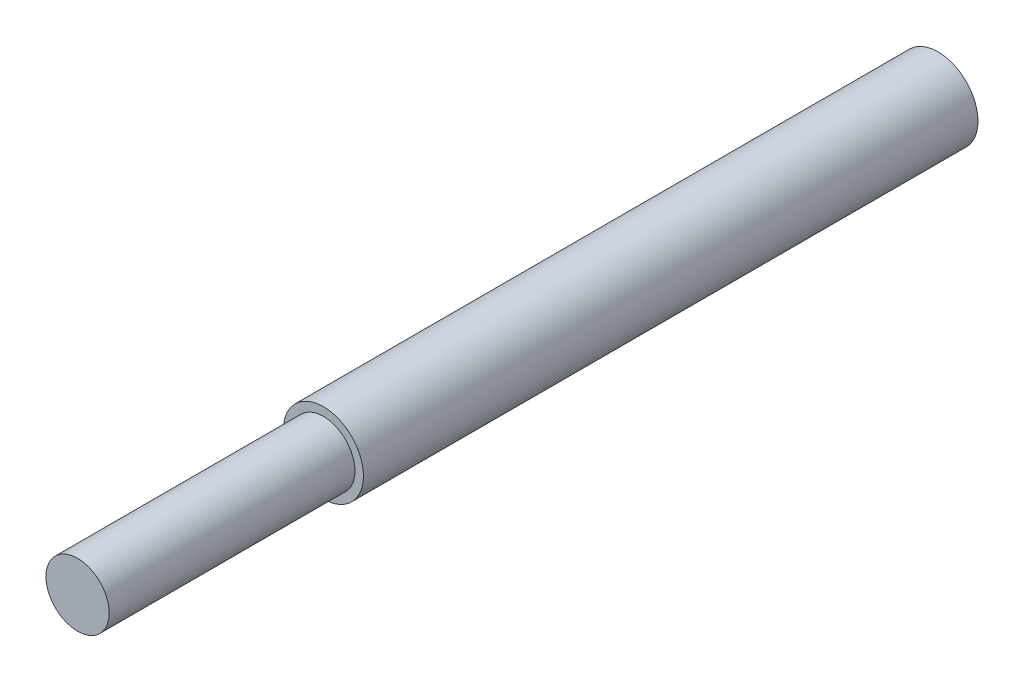
from build123d import *

# Parameters (mm, degrees)
SKETCH1_W           = 1.14
SKETCH1_H           = 17.5
SKETCH2_R           = 0.9
BOSS_EXTRUDE1_DEPTH = 7


with BuildPart() as part:
    # Sketch1 → Revolve1 (revolve)
    with BuildSketch(Plane(origin=(0, 0, 0), x_dir=(1, 0, 0), z_dir=(0, 1, 0))):
        with Locations((0.57, -8.75)):
            Rectangle(SKETCH1_W, SKETCH1_H)
    revolve(axis=Axis((0, 0, 0), (0, 0, 1)))

    # Sketch2 → Boss-Extrude1 (add)
    with BuildSketch(Plane.XY.offset(17.5)):
        Circle(SKETCH2_R)
    extrude(amount=BOSS_EXTRUDE1_DEPTH)


solid = part.part
